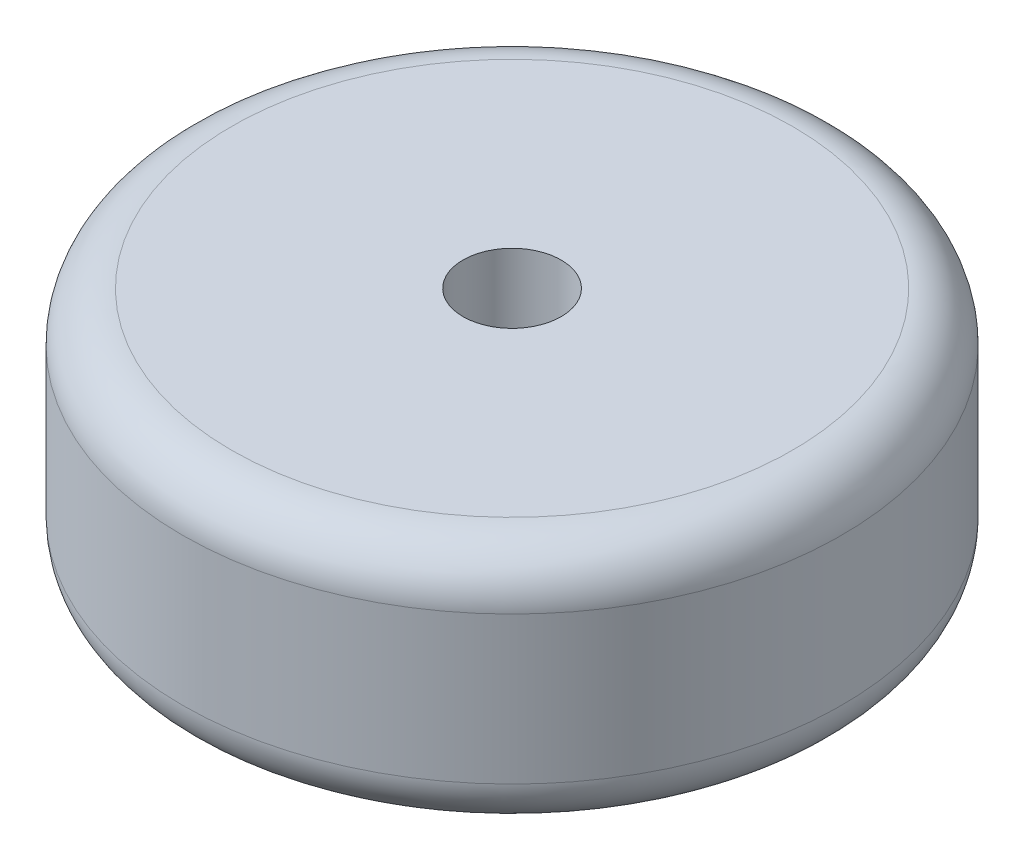
from build123d import *

# Parameters (mm, degrees)
SKETCH1_R           = 6.715
BOSS_EXTRUDE1_DEPTH = 5
FILLET1_R           = 1
CUT_EXTRUDE1_REACH  = 12.732
SKETCH2_R           = 1


with BuildPart() as part:
    # Sketch1 → Boss-Extrude1 (new body)
    with BuildSketch(Plane(origin=(0, 0, 0), x_dir=(1, 0, 0), z_dir=(0, 1, 0))):
        with Locations(Location((0, 0, 0), (0, 0, 270))):
            Circle(SKETCH1_R)
    extrude(amount=BOSS_EXTRUDE1_DEPTH)

    # Fillet1
    fillet1_edges = [part.edges().sort_by_distance(p)[0] for p in [
        (0, 0, -6.715),
        (0, 5, -6.715),
    ]]
    fillet(fillet1_edges, radius=FILLET1_R)

    # Sketch2 → Cut-Extrude1 (cut, up to next)
    with BuildSketch(Plane(origin=(0, 5, 0), x_dir=(1, 0, 0), z_dir=(0, 1, 0)), mode=Mode.PRIVATE) as cut_extrude1_sk1:
        with Locations(Location((0, 0, 0), (0, 0, 270))):
            Circle(SKETCH2_R)
    cut_extrude1_tool1 = extrude(cut_extrude1_sk1.sketch, amount=-CUT_EXTRUDE1_REACH, mode=Mode.PRIVATE) & part.part
    add(cut_extrude1_tool1.solids().sort_by_distance((0, 5, 0))[0], mode=Mode.SUBTRACT)


solid = part.part
